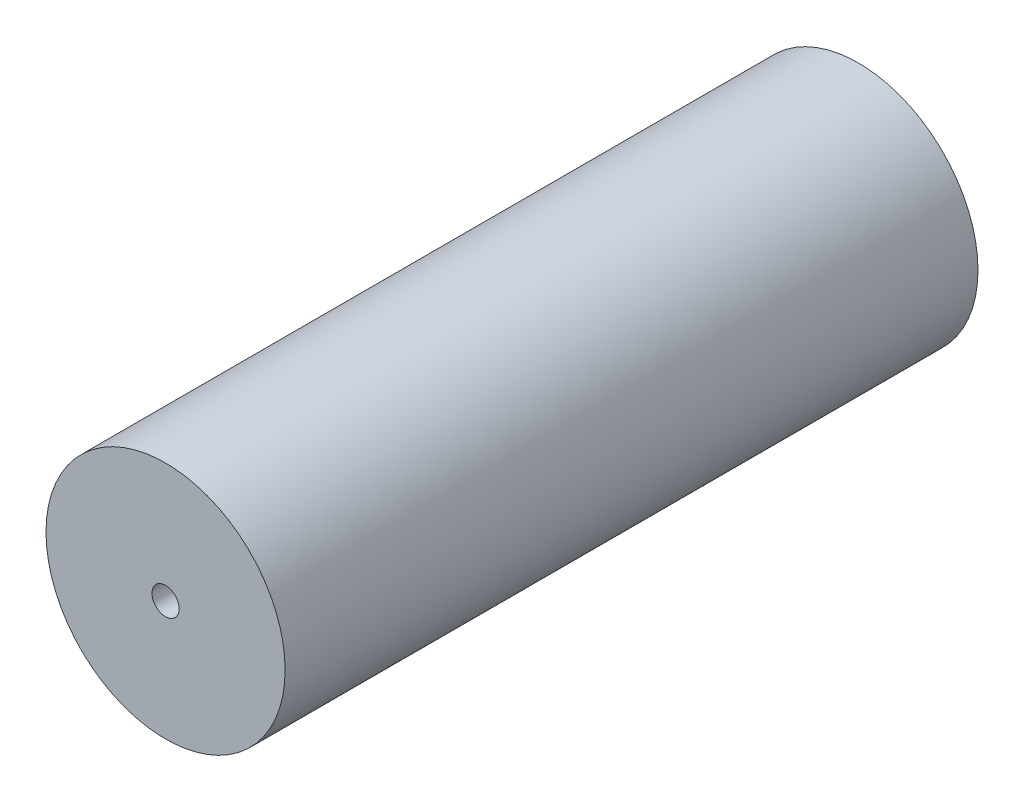
from build123d import *

# Parameters (mm, degrees)
SKETCH2_R           = 22
BOSS_EXTRUDE1_DEPTH = 127.5
SKETCH3_R           = 2.5
CUT_EXTRUDE1_DEPTH  = 135
SKETCH5_R           = 17.5
CUT_EXTRUDE2_DEPTH  = 30


with BuildPart() as part:
    # Sketch2 → Boss-Extrude1 (new body)
    with BuildSketch(Plane.XY):
        Circle(SKETCH2_R)
    extrude(amount=BOSS_EXTRUDE1_DEPTH)

    # Sketch3 → Cut-Extrude1 (cut)
    with BuildSketch(Plane(origin=(0, 0, 0), x_dir=(-1, 0, 0), z_dir=(0, 0, -1))):
        Circle(SKETCH3_R)
    extrude(amount=-CUT_EXTRUDE1_DEPTH, mode=Mode.SUBTRACT)

    # Sketch5 → Cut-Extrude2 (cut)
    with BuildSketch(Plane(origin=(0, 0, 0), x_dir=(-1, 0, 0), z_dir=(0, 0, -1))):
        Circle(SKETCH5_R)
    extrude(amount=-CUT_EXTRUDE2_DEPTH, mode=Mode.SUBTRACT)


solid = part.part
